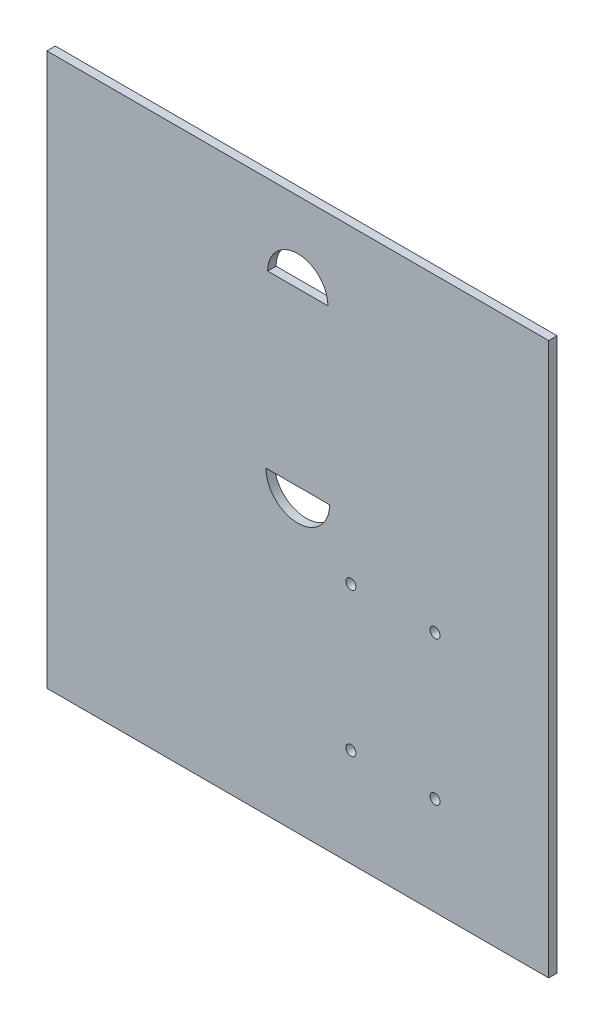
from build123d import *

# Parameters (mm, degrees)
SKETCH1_W               = 250
SKETCH1_H               = 275
BOSS_EXTRUDE1_DEPTH     = 4.2
ESQUISSE1_R             = 2.50000008
ENL_V_MAT_EXTRU_1_DEPTH = 276.146260086


with BuildPart() as part:
    # Sketch1 → Boss-Extrude1 (new body)
    with BuildSketch(Plane.XY):
        with Locations((-95.228215768, -27.385892116)):
            Rectangle(SKETCH1_W, SKETCH1_H)
    extrude(amount=BOSS_EXTRUDE1_DEPTH)

    # Esquisse1 → Enlèv. mat.-Extru.1 (cut, through all)
    with BuildSketch(Plane.XY.offset(4.2)):
        with Locations((-68.768525983, -115.943585425)):
            Circle(ESQUISSE1_R)
        with Locations((-26.858525983, -115.943585425)):
            Circle(ESQUISSE1_R)
        with Locations((-68.768525983, -44.188585425)):
            Circle(ESQUISSE1_R)
        with Locations((-26.858525983, -44.188585425)):
            Circle(ESQUISSE1_R)
        with BuildLine():
            Line((-110.228215768, 70.114107884), (-80.228215768, 70.114107884))
            ThreePointArc((-80.228215768, 70.114107884), (-95.228215768, 85.114107884), (-110.228215768, 70.114107884))
        make_face()
        with BuildLine():
            Line((-111.073893882, -15.305892116), (-79.382537653, -15.305892116))
            ThreePointArc((-79.382537653, -15.305892116), (-95.228215768, -31.151570231), (-111.073893882, -15.305892116))
        make_face()
    extrude(amount=-ENL_V_MAT_EXTRU_1_DEPTH, mode=Mode.SUBTRACT)


solid = part.part
